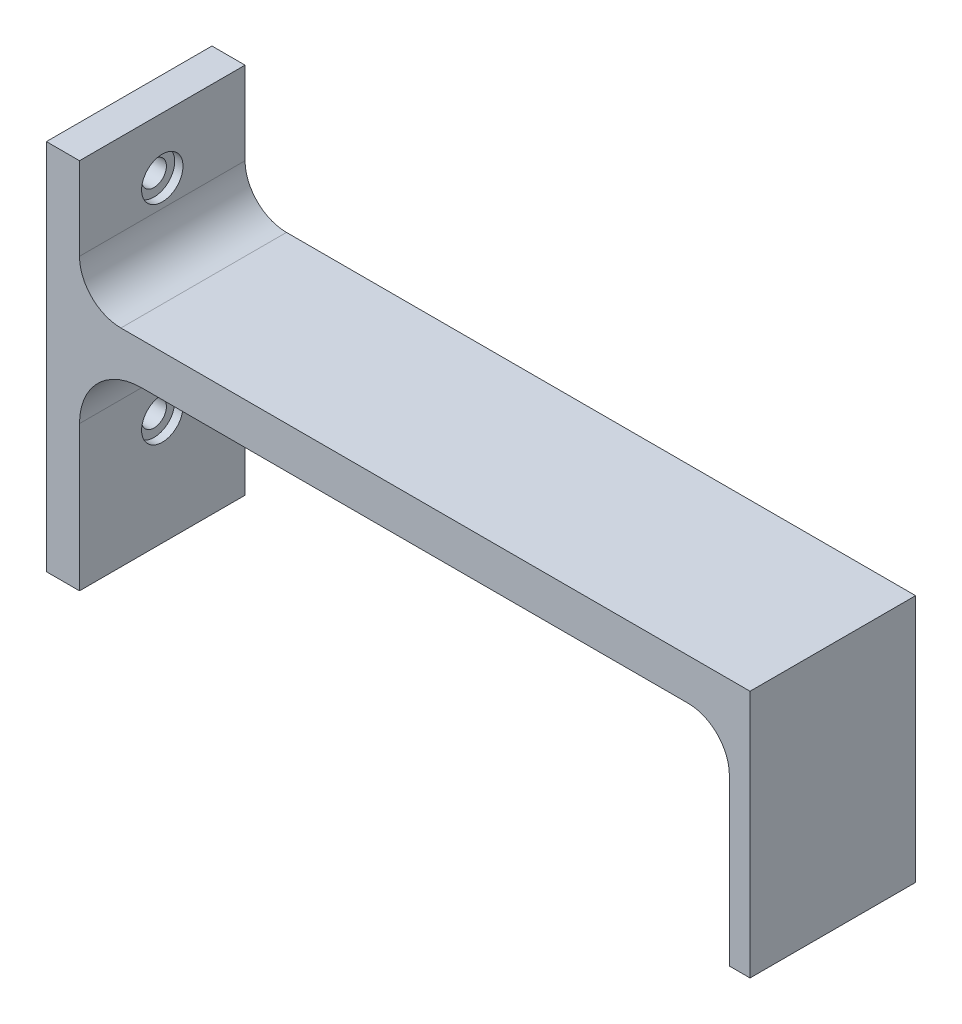
from build123d import *

# Parameters (mm, degrees)
ESQUISSE2_W             = 170
ESQUISSE2_H             = 40
BOSS_EXTRU_1_DEPTH      = 10
ESQUISSE3_W             = 8
ESQUISSE3_H             = 40
BOSS_EXTRU_2_DEPTH      = 50
ESQUISSE4_W             = 5
ESQUISSE4_H             = 40
BOSS_EXTRU_3_DEPTH      = 50
CONG_1_R                = 15
CONG_2_R                = 10
ESQUISSE7_W             = 8
ESQUISSE7_H             = 40
BOSS_EXTRU_4_DEPTH      = 30
CONG_3_R                = 10
ENL_V_MAT_EXTRU_3_REACH = 180.326
ESQUISSE8_R             = 3
ESQUISSE10_R            = 5
ENL_V_MAT_EXTRU_4_DEPTH = 2
ESQUISSE11_R            = 5
ENL_V_MAT_EXTRU_5_DEPTH = 2


with BuildPart() as part:
    # Esquisse2 → Boss.-Extru.1 (new body)
    with BuildSketch(Plane(origin=(0, 0, 0), x_dir=(1, 0, 0), z_dir=(0, 1, 0))):
        Rectangle(ESQUISSE2_W, ESQUISSE2_H)
    extrude(amount=BOSS_EXTRU_1_DEPTH)

    # Esquisse3 → Boss.-Extru.2 (add)
    with BuildSketch(Plane.XZ):
        with Locations((-81, 0)):
            Rectangle(ESQUISSE3_W, ESQUISSE3_H)
    extrude(amount=BOSS_EXTRU_2_DEPTH)

    # Esquisse4 → Boss.-Extru.3 (add)
    with BuildSketch(Plane.XZ):
        with Locations((82.5, 0)):
            Rectangle(ESQUISSE4_W, ESQUISSE4_H)
    extrude(amount=BOSS_EXTRU_3_DEPTH)

    # Congé1
    cong_1_edges = [part.edges().sort_by_distance(p)[0] for p in [
        (-77, 0, 0),
    ]]
    fillet(cong_1_edges, radius=CONG_1_R)

    # Congé2
    cong_2_edges = [part.edges().sort_by_distance(p)[0] for p in [
        (80, 0, 0),
    ]]
    fillet(cong_2_edges, radius=CONG_2_R)

    # Esquisse7 → Boss.-Extru.4 (add)
    with BuildSketch(Plane(origin=(0, 10, 0), x_dir=(1, 0, 0), z_dir=(0, 1, 0))):
        with Locations((-81, 0)):
            Rectangle(ESQUISSE7_W, ESQUISSE7_H)
    extrude(amount=BOSS_EXTRU_4_DEPTH)

    # Congé3
    cong_3_edges = [part.edges().sort_by_distance(p)[0] for p in [
        (-77, 10, 0),
    ]]
    fillet(cong_3_edges, radius=CONG_3_R)

    # Esquisse8 → Enlèv. mat.-Extru.3 (cut, up to next)
    with BuildSketch(Plane.ZY.offset(85), mode=Mode.PRIVATE) as enl_v_mat_extru_3_sk1:
        with Locations((0, 26.38656459)):
            Circle(ESQUISSE8_R)
    enl_v_mat_extru_3_tool1 = extrude(enl_v_mat_extru_3_sk1.sketch, amount=-ENL_V_MAT_EXTRU_3_REACH, mode=Mode.PRIVATE) & part.part
    # Esquisse8 → Enlèv. mat.-Extru.3 (cut, up to next)
    with BuildSketch(Plane.ZY.offset(85), mode=Mode.PRIVATE) as enl_v_mat_extru_3_sk2:
        with Locations((0, -23.907675409)):
            Circle(ESQUISSE8_R)
    enl_v_mat_extru_3_tool2 = extrude(enl_v_mat_extru_3_sk2.sketch, amount=-ENL_V_MAT_EXTRU_3_REACH, mode=Mode.PRIVATE) & part.part
    add(enl_v_mat_extru_3_tool1.solids().sort_by_distance((-85, 26.386565, 0))[0], mode=Mode.SUBTRACT)
    add(enl_v_mat_extru_3_tool2.solids().sort_by_distance((-85, -23.907675, 0))[0], mode=Mode.SUBTRACT)

    # Esquisse10 → Enlèv. mat.-Extru.4 (cut)
    with BuildSketch(Plane(origin=(-77, 0, 0), x_dir=(0, 0, -1), z_dir=(1, 0, 0))):
        with Locations((0, -23.907675409)):
            Circle(ESQUISSE10_R)
    extrude(amount=-ENL_V_MAT_EXTRU_4_DEPTH, mode=Mode.SUBTRACT)

    # Esquisse11 → Enlèv. mat.-Extru.5 (cut)
    with BuildSketch(Plane(origin=(-77, 0, 0), x_dir=(0, 0, -1), z_dir=(1, 0, 0))):
        with Locations((0, 26.38656459)):
            Circle(ESQUISSE11_R)
    extrude(amount=-ENL_V_MAT_EXTRU_5_DEPTH, mode=Mode.SUBTRACT)


solid = part.part
